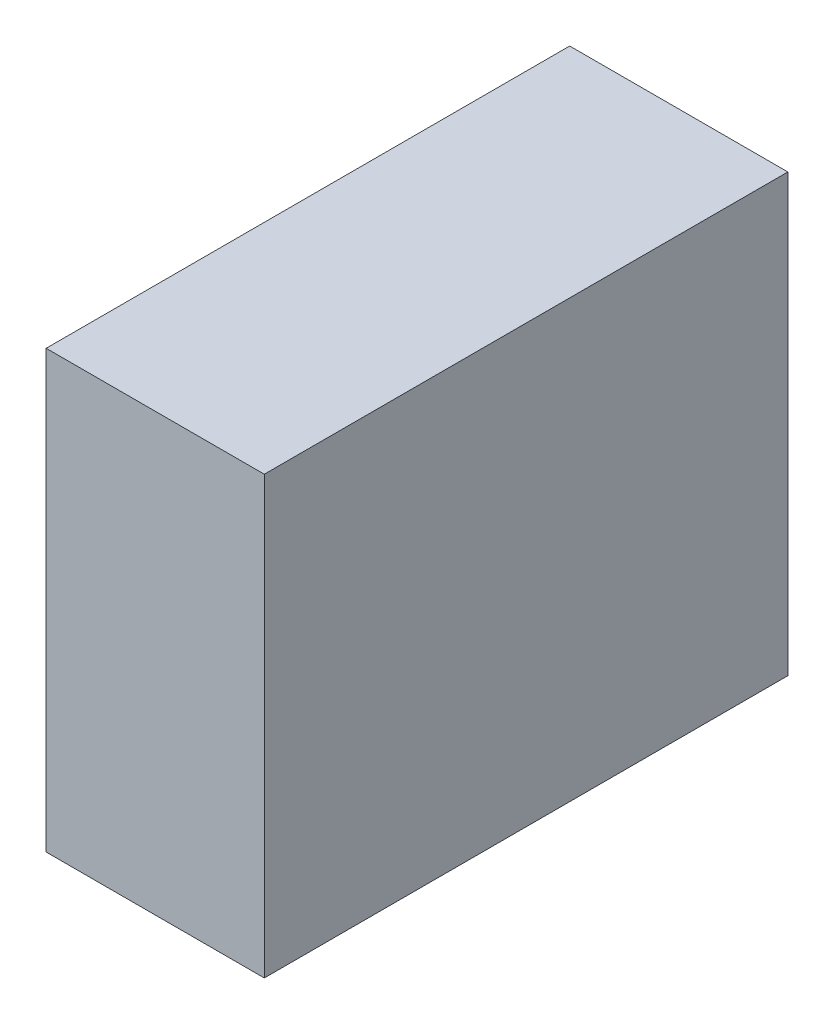
from build123d import *

# Parameters (mm, degrees)
OVEN_PANO_SURUCU_PRES_1_START = -128
SKETCH1_W                     = 50
SKETCH1_H                     = 100
OVEN_PANO_SURUCU_PRES_1_DEPTH = 120


with BuildPart() as part:
    # Sketch1 → OVEN_pano_surucu_pres_1 (new body)
    with BuildSketch(Plane.XY.offset(OVEN_PANO_SURUCU_PRES_1_START)):
        with Locations((465, 250)):
            Rectangle(SKETCH1_W, SKETCH1_H)
    extrude(amount=-OVEN_PANO_SURUCU_PRES_1_DEPTH)


solid = part.part
